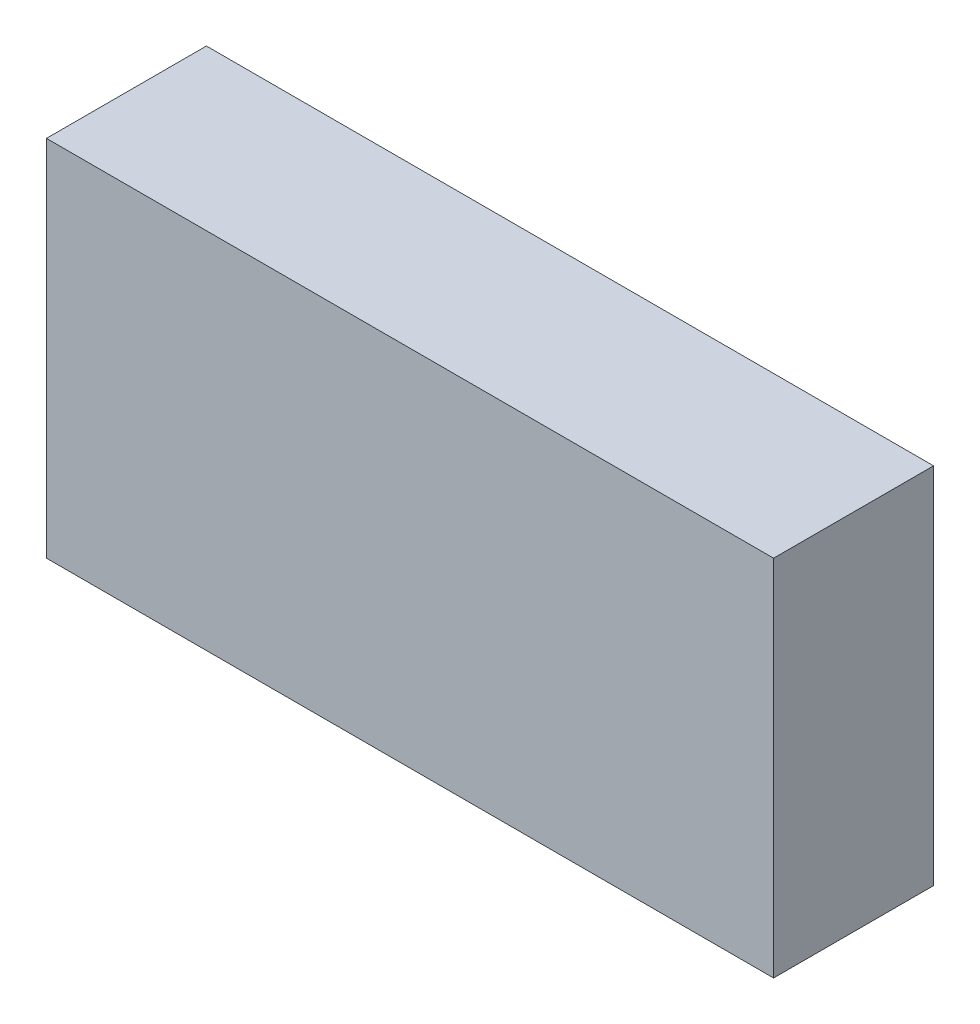
from build123d import *

# Parameters (mm, degrees)
BOSS_EXTRUDE1_DEPTH      = 10
BOSS_EXTRUDE1_DEPTH_BACK = 1
SKETCH3_W                = 50
SKETCH3_H                = 25


with BuildPart() as part:
    # Sketch3 → Boss-Extrude1 (new, two sides: drawn at the far end of the back side and taken through both)
    with BuildSketch(Plane.XY.offset(-BOSS_EXTRUDE1_DEPTH_BACK)):
        with Locations((25, 12.5)):
            Rectangle(SKETCH3_W, SKETCH3_H)
    extrude(amount=BOSS_EXTRUDE1_DEPTH + BOSS_EXTRUDE1_DEPTH_BACK)


solid = part.part
